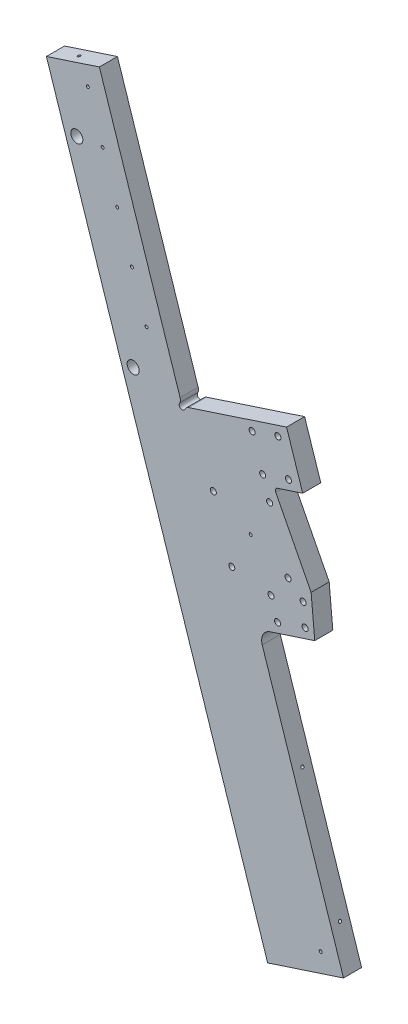
from build123d import *

# Parameters (mm, degrees)
BOSS_EXTRUDE1_DEPTH        = 19.05
BOSS_EXTRUDE2_DEPTH        = 19.05
FILLET1_R                  = 3.175
FILLET2_R                  = 12.7
CUT_EXTRUDE1_DEPTH         = 965.552600368
CUT_EXTRUDE1_DEPTH_BACK    = 965.552600368
SKETCH47_R                 = 3.175
FILLET4_R                  = 6.35
F_0_25_DIAMETER_HOLE1_D    = 6.35
HOLE6_D                    = 3.175
HOLE6_DEPTH                = 38.1
HOLE6_CSINK_D              = 10.16
HOLE6_CSINK_ANGLE          = 82
HOLE6_TIP                  = 0.953866233
HOLE9_D                    = 3.175
HOLE9_DEPTH                = 57.15
HOLE9_CSINK_D              = 10.16
HOLE9_CSINK_ANGLE          = 82
HOLE9_TIP                  = 0.953866233
HOLE14_D                   = 3.175
HOLE14_DEPTH               = 31.75
HOLE14_CSINK_D             = 10.16
HOLE14_CSINK_ANGLE         = 82
HOLE14_TIP                 = 0.953866233
HOLE15_D                   = 3.175
HOLE15_DEPTH               = 31.75
HOLE15_CSINK_D             = 10.16
HOLE15_CSINK_ANGLE         = 82
HOLE15_TIP                 = 0.953866233
HOLE17_D                   = 3.175
HOLE17_DEPTH               = 31.75
HOLE17_CSINK_D             = 10.16
HOLE17_CSINK_ANGLE         = 82
HOLE17_TIP                 = 0.953866233
F_1_2_0_5_DIAMETER_HOLE3_D = 12.7


with BuildPart() as part:
    # Sketch1 → Boss-Extrude1 (new body)
    with BuildSketch(Plane.XY):
        Polygon((-247.274665566, 82.142339986), (-327.22102196, 55.917162383), (-560.337153612, 766.561933763), (-504.525442447, 784.870110692), (-417.251419261, 518.818903446), (-393.116774032, 526.735904121), align=None)
    extrude(amount=-BOSS_EXTRUDE1_DEPTH)

    # Sketch2 → Boss-Extrude2 (add, through all)
    with BuildSketch(Plane.XY):
        Polygon((-393.116774032, 526.735904121), (-336.901176267, 355.36500697), (-277.604402796, 374.816405204), (-281.415155825, 417.005352091), (-320.44916939, 493.083731154), (-290.280862854, 502.979981998), (-307.307307279, 554.884385267), align=None)
    extrude(amount=-BOSS_EXTRUDE2_DEPTH)

    # Fillet1
    fillet1_edges = [part.edges().sort_by_distance(p)[0] for p in [
        (-320.44916939, 493.083731154, -9.525),
    ]]
    fillet(fillet1_edges, radius=FILLET1_R)

    # Fillet2
    fillet2_edges = [part.edges().sort_by_distance(p)[0] for p in [
        (-336.901176267, 355.36500697, -9.525),
    ]]
    fillet(fillet2_edges, radius=FILLET2_R)

    # Sketch47 → Cut-Extrude1 (cut, two sides: drawn at the far end of the back side and taken through both)
    with BuildSketch(Plane(origin=(0, 0, -19.05), x_dir=(-1, 0, 0), z_dir=(0, 0, -1)).offset(-CUT_EXTRUDE1_DEPTH_BACK)):
        with Locations((417.251419261, 518.818903446)):
            Circle(SKETCH47_R)
    extrude(amount=CUT_EXTRUDE1_DEPTH + CUT_EXTRUDE1_DEPTH_BACK, mode=Mode.SUBTRACT)

    # Fillet4
    fillet4_edges = [part.edges().sort_by_distance(p)[0] for p in [
        (-418.241044345, 521.8357341, -9.525),
        (-414.234588607, 519.80852853, -9.525),
    ]]
    fillet(fillet4_edges, radius=FILLET4_R)

    # 0.25_ Diameter Hole1 (through all)
    with Locations(Plane.XY):
        with Locations((-563.45033927, 698.544682362), (-504.072834209, 517.534843147), (-343.557230523, 532.968767209), (-316.40575464, 541.875392969), (-305.317060721, 508.071973621), (-332.468536604, 499.165347862), (-384.427899865, 457.805801818), (-325.157897499, 477.248418201), (-305.715281117, 417.978415836), (-364.985283482, 398.535799453), (-323.698740376, 393.110483865), (-289.824308357, 404.222472403), (-287.772364418, 381.505347156), (-316.771364786, 371.99266929)):
            Hole(F_0_25_DIAMETER_HOLE1_D / 2)

    # Hole6
    with Locations(Plane(origin=(313.774034822, -375.700785937, -19.05), x_dir=(-0.9977564584489054, 0.06694811142592419, 0), z_dir=(0, 0, -1))):
        with Locations((615.24080496, 429.781381762), (710.914924699, 391.126528253), (904.68821492, 1078.38439498), (976.811864753, 1049.244548945), (835.937309391, 717.51890547), (711.83598555, 767.659094962)):
            CounterSinkHole(HOLE6_D / 2, HOLE6_CSINK_D / 2, depth=HOLE6_DEPTH, counter_sink_angle=HOLE6_CSINK_ANGLE)
            with Locations((0, 0, -(HOLE6_DEPTH + HOLE6_TIP / 2))):  # 118° drill point
                Cone(0, HOLE6_D / 2, HOLE6_TIP, mode=Mode.SUBTRACT)

    # Hole9
    with Locations(Plane(origin=(313.774034822, -375.700785937, -38.1), x_dir=(-0.9977564584489054, 0.06694811142592419, 0), z_dir=(0, 0, -1))):
        with Locations((848.944412528, 940.413642522), (885.927448463, 1031.949868564), (867.435930496, 986.181755543), (830.452894561, 894.645529501)):
            CounterSinkHole(HOLE9_D / 2, HOLE9_CSINK_D / 2, depth=HOLE9_DEPTH, counter_sink_angle=HOLE9_CSINK_ANGLE)
            with Locations((0, 0, -(HOLE9_DEPTH + HOLE9_TIP / 2))):  # 118° drill point
                Cone(0, HOLE9_D / 2, HOLE9_TIP, mode=Mode.SUBTRACT)

    # Hole14
    with Locations(Plane(origin=(-45.102820315, -493.424841018, 72.024999997), x_dir=(0, 0, -1), z_dir=(0.9501828830204607, 0.31169293995040287, 1.2726359102629282e-15))):
        with Locations((174.999999994, 685.961004241), (174.999999994, 549.837259632), (174.999999994, 413.713515022), (81.549999997, 779.649723129), (81.549999997, 652.344645962), (62.499999997, 662.953402392), (62.499999997, 769.040966698), (-62.499999997, 769.040966698), (-62.499999997, 662.953402392), (-81.549999997, 652.344645962), (-81.549999997, 779.649723129), (-174.999999994, 413.713515022), (-174.999999994, 549.837259632), (-174.999999994, 685.961004241), (-82.737499997, 600.384620239), (0, 600.384620239), (82.737499997, 600.384620239), (0, 376.737770337), (-82.737499997, 376.737770337), (82.737499997, 376.737770337)):
            CounterSinkHole(HOLE14_D / 2, HOLE14_CSINK_D / 2, depth=HOLE14_DEPTH, counter_sink_angle=HOLE14_CSINK_ANGLE)
            with Locations((0, 0, -(HOLE14_DEPTH + HOLE14_TIP / 2))):  # 118° drill point
                Cone(0, HOLE14_D / 2, HOLE14_TIP, mode=Mode.SUBTRACT)

    # Hole15
    with Locations(Plane(origin=(-155.217483245, -529.546269464, 72.024999997), x_dir=(0, 0, 1), z_dir=(-0.9501828830204603, -0.3116929399504042, -1.2203303954814629e-15))):
        with Locations((-78.374999997, 1310.187770338), (-78.374999997, 1138.737770338), (78.374999997, 1138.737770338), (78.374999997, 1310.187770338)):
            CounterSinkHole(HOLE15_D / 2, HOLE15_CSINK_D / 2, depth=HOLE15_DEPTH, counter_sink_angle=HOLE15_CSINK_ANGLE)
            with Locations((0, 0, -(HOLE15_DEPTH + HOLE15_TIP / 2))):  # 118° drill point
                Cone(0, HOLE15_D / 2, HOLE15_TIP, mode=Mode.SUBTRACT)

    # Hole17
    with Locations(Plane(origin=(-111.425869636, 920.503328092, 72.024999997), x_dir=(0, 0, -1), z_dir=(-0.31169293995040415, 0.9501828830204603, 0))):
        with Locations((81.549999997, 448.336332751), (-81.549999997, 448.336332751)):
            CounterSinkHole(HOLE17_D / 2, HOLE17_CSINK_D / 2, depth=HOLE17_DEPTH, counter_sink_angle=HOLE17_CSINK_ANGLE)
            with Locations((0, 0, -(HOLE17_DEPTH + HOLE17_TIP / 2))):  # 118° drill point
                Cone(0, HOLE17_D / 2, HOLE17_TIP, mode=Mode.SUBTRACT)

    # 1/2 (0.5) Diameter Hole3 (through all)
    with Locations(Plane.XY):
        with Locations((-468.912808487, 528.603872083), (-528.290313547, 709.613711299)):
            Hole(F_1_2_0_5_DIAMETER_HOLE3_D / 2)


solid = part.part
